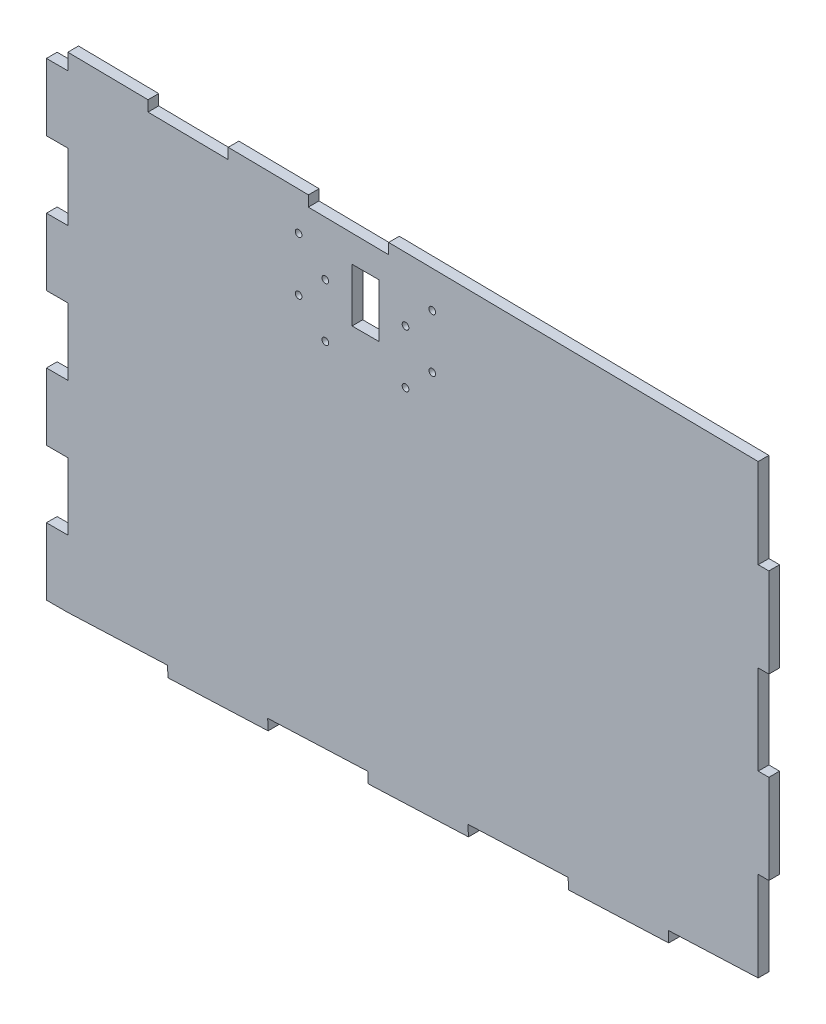
from build123d import *

# Parameters (mm, degrees)
BOSS_EXTRUDE1_DEPTH = 10.16
CUT_EXTRUDE1_DEPTH  = 939.689084707
SKETCH4_W           = 129.547530324
SKETCH4_H           = 444.037072
CUT_EXTRUDE3_DEPTH  = 913.782619918
SKETCH5_W           = 10.16
SKETCH5_H           = 84.922739191
CUT_EXTRUDE5_DEPTH  = 833.736048251
CUT_EXTRUDE6_DEPTH  = 833.736048251
SKETCH11_R          = 3.175
SKETCH11_W          = 25.4
SKETCH11_H          = 50.8
CUT_EXTRUDE8_DEPTH  = 833.736048251


with BuildPart() as part:
    # Sketch1 → Boss-Extrude1 (new body)
    with BuildSketch(Plane.XY):
        with BuildLine():
            Line((20.32, 73.849956434), (0, 73.849956434))
            Line((0, 73.849956434), (0, 10.164894956))
            Line((0, 10.164894956), (20.32, 10.164894956))
            Line((20.32, 10.164894956), (115.06781826, 14.091181531))
            Line((115.06781826, 14.091181531), (115.488322648, 3.943711998))
            Line((115.488322648, 3.943711998), (210.656645296, 7.887423995))
            Line((210.656645296, 7.887423995), (210.236140908, 18.034893528))
            Line((210.236140908, 18.034893528), (305.404463556, 21.978605526))
            Line((305.404463556, 21.978605526), (305.824967945, 11.831135993))
            Line((305.824967945, 11.831135993), (400.993290593, 15.77484799))
            Line((400.993290593, 15.77484799), (400.572786204, 25.922317523))
            Line((400.572786204, 25.922317523), (495.741108852, 29.866029521))
            Line((495.741108852, 29.866029521), (496.161613241, 19.718559988))
            Line((496.161613241, 19.718559988), (591.329935889, 23.662271985))
            Line((591.329935889, 23.662271985), (590.909431501, 33.809741518))
            Line((590.909431501, 33.809741518), (686.077754149, 37.753453516))
            Line((686.077754149, 37.753453516), (686.498258538, 27.605983983))
            Line((686.498258538, 27.605983983), (781.666581186, 31.54969598))
            Line((781.666581186, 31.54969598), (781.246076797, 41.697165514))
            Line((781.246076797, 41.697165514), (781.246076797, 471.95159927))
            ThreePointArc((781.246076797, 471.95159927), (401.049995582, 500.057636465), (20.32, 519.645386783))
            Line((20.32, 519.645386783), (20.32, 455.960325305))
            Line((20.32, 455.960325305), (0, 455.960325305))
            Line((0, 455.960325305), (0, 392.275263826))
            Line((0, 392.275263826), (20.32, 392.275263826))
            Line((20.32, 392.275263826), (20.32, 328.590202348))
            Line((20.32, 328.590202348), (0, 328.590202348))
            Line((0, 328.590202348), (0, 264.905140869))
            Line((0, 264.905140869), (20.32, 264.905140869))
            Line((20.32, 264.905140869), (20.32, 201.220079391))
            Line((20.32, 201.220079391), (0, 201.220079391))
            Line((0, 201.220079391), (0, 137.535017912))
            Line((0, 137.535017912), (20.32, 137.535017912))
            Line((20.32, 137.535017912), (20.32, 73.849956434))
        make_face()
    extrude(amount=BOSS_EXTRUDE1_DEPTH)

    # Sketch2 → Cut-Extrude1 (cut, through all)
    with BuildSketch(Plane.XY.offset(10.16)):
        Polygon((20.32, 471.23904919), (781.246076797, 460.948390721), (781.246076797, 535.017906983), (20.32, 535.017906983), align=None)
    extrude(amount=-CUT_EXTRUDE1_DEPTH, mode=Mode.SUBTRACT)

    # Sketch4 → Cut-Extrude3 (cut, through all)
    with BuildSketch(Plane(origin=(0, 0, 0), x_dir=(-1, 0, 0), z_dir=(0, 0, -1))):
        with Locations((-751.2720237, 249.624519983)):
            Rectangle(SKETCH4_W, SKETCH4_H)
    extrude(amount=-CUT_EXTRUDE3_DEPTH, mode=Mode.SUBTRACT)

    # Sketch5 → Cut-Extrude5 (cut, through all)
    with BuildSketch(Plane(origin=(0, 0, 0), x_dir=(-1, 0, 0), z_dir=(0, 0, -1))):
        Polygon((-686.498258538, 122.676192707), (-686.498258538, 37.753453516), (-686.077754149, 37.753453516), (-676.338258538, 37.753453516), (-676.338258538, 122.676192707), align=None)
        with Locations((-681.418258538, 250.060301493)):
            Rectangle(SKETCH5_W, SKETCH5_H)
        Polygon((-686.498258538, 462.229747042), (-686.498258538, 377.444410279), (-676.338258538, 377.444410279), (-676.338258538, 462.367149469), align=None)
        Polygon((-676.338258538, 37.349855295), (-686.077754149, 37.753453516), (-686.498258538, 27.605983983), (-686.498258538, 26.157835014), (-676.338258538, 26.157835014), align=None)
        Polygon((-686.077754149, 37.753453516), (-686.498258538, 37.753453516), (-686.498258538, 27.605983983), align=None)
        Polygon((-676.338258538, 37.753453516), (-686.077754149, 37.753453516), (-676.338258538, 37.349855295), align=None)
    extrude(amount=-CUT_EXTRUDE5_DEPTH, mode=Mode.SUBTRACT)

    # Sketch9 → Cut-Extrude6 (cut, through all)
    with BuildSketch(Plane(origin=(0, 0, 0), x_dir=(-1, 0, 0), z_dir=(0, 0, -1))):
        Polygon((-248.83741583, 457.991507139), (-248.974805694, 468.150578161), (-325.167838357, 467.12015418), (-325.030448493, 456.961083159), align=None)
        Polygon((-96.52, 470.208530984), (-96.52, 460.048530984), (-172.713032663, 459.018107004), (-172.713032663, 469.178107004), align=None)
    extrude(amount=-CUT_EXTRUDE6_DEPTH, mode=Mode.SUBTRACT)

    # Sketch11 → Cut-Extrude8 (cut, through all)
    with BuildSketch(Plane.XY.offset(10.16)):
        with Locations((366.619369126, 431.770831078)):
            Circle(SKETCH11_R)
        with Locations((366.619369126, 380.970831078)):
            Circle(SKETCH11_R)
        with Locations((239.619369126, 431.770831078)):
            Circle(SKETCH11_R)
        with Locations((239.619369126, 380.970831078)):
            Circle(SKETCH11_R)
        with Locations((265.019369126, 406.370831078)):
            Circle(SKETCH11_R)
        with Locations(Location((341.219369126, 406.370831078, 0), (0, 0, 180))):
            Circle(SKETCH11_R)
        with Locations((265.019369126, 355.570831078)):
            Circle(SKETCH11_R)
        with Locations(Location((341.219369126, 355.570831078, 0), (0, 0, 180))):
            Circle(SKETCH11_R)
        with Locations((303.119369126, 406.370831078)):
            Rectangle(SKETCH11_W, SKETCH11_H)
    extrude(amount=-CUT_EXTRUDE8_DEPTH, mode=Mode.SUBTRACT)


solid = part.part
